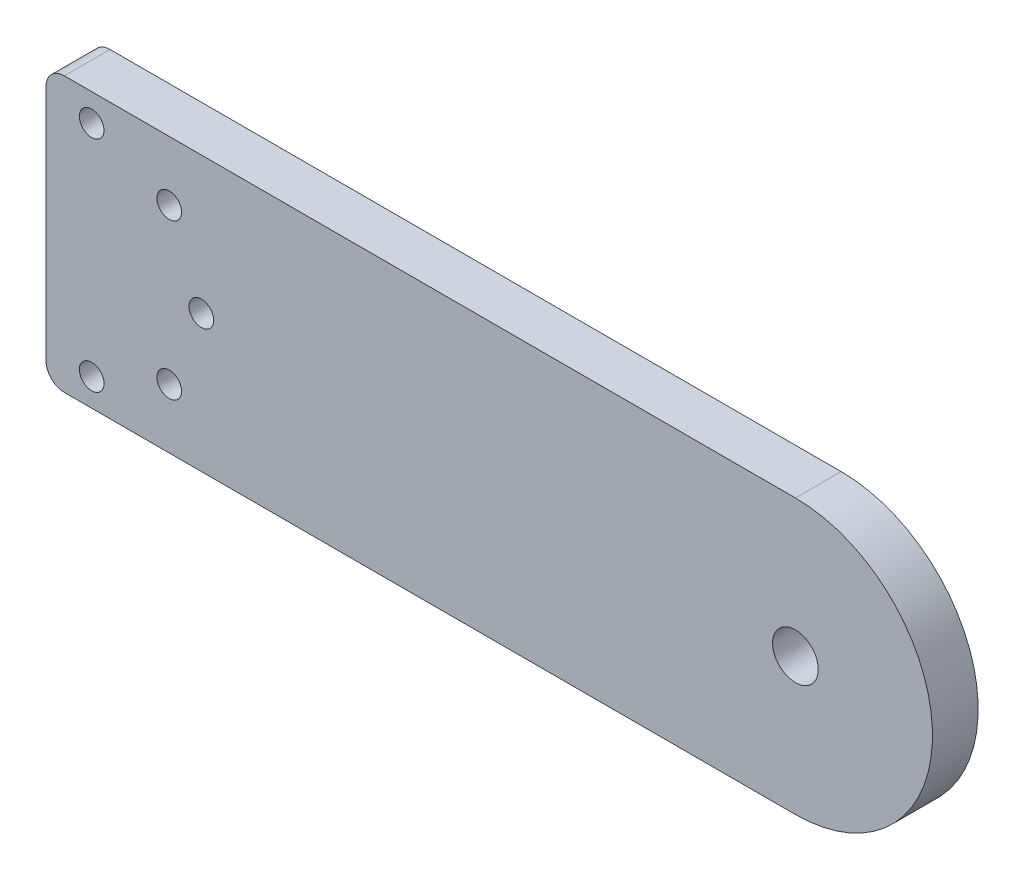
from build123d import *

# Parameters (mm, degrees)
SKETCH_1_R      = 1.35
SKETCH_1_R_2    = 2.5
EXTRUDE_1_DEPTH = 5


with BuildPart() as part:
    # 草图1 → 凸台-拉伸1 (new body)
    with BuildSketch(Plane.XY):
        with BuildLine():
            Line((-40, 13), (-40, -13))
            ThreePointArc((-40, -13), (-39.414213562, -14.414213562), (-38, -15))
            Line((-38, -15), (42, -15))
            ThreePointArc((42, -15), (57, 0), (42, 15))
            Line((42, 15), (-38, 15))
            ThreePointArc((-38, 15), (-39.414213562, 14.414213562), (-40, 13))
        make_face()
        with Locations((-35, -12)):
            Circle(SKETCH_1_R, mode=Mode.SUBTRACT)
        with Locations((-26.514718626, -8.485281374)):
            Circle(SKETCH_1_R, mode=Mode.SUBTRACT)
        with Locations((-35, 12)):
            Circle(SKETCH_1_R, mode=Mode.SUBTRACT)
        with Locations((-26.514718626, 8.485281374)):
            Circle(SKETCH_1_R, mode=Mode.SUBTRACT)
        with Locations((-23, 0)):
            Circle(SKETCH_1_R, mode=Mode.SUBTRACT)
        with Locations((42, 0)):
            Circle(SKETCH_1_R_2, mode=Mode.SUBTRACT)
    extrude(amount=EXTRUDE_1_DEPTH)


solid = part.part
